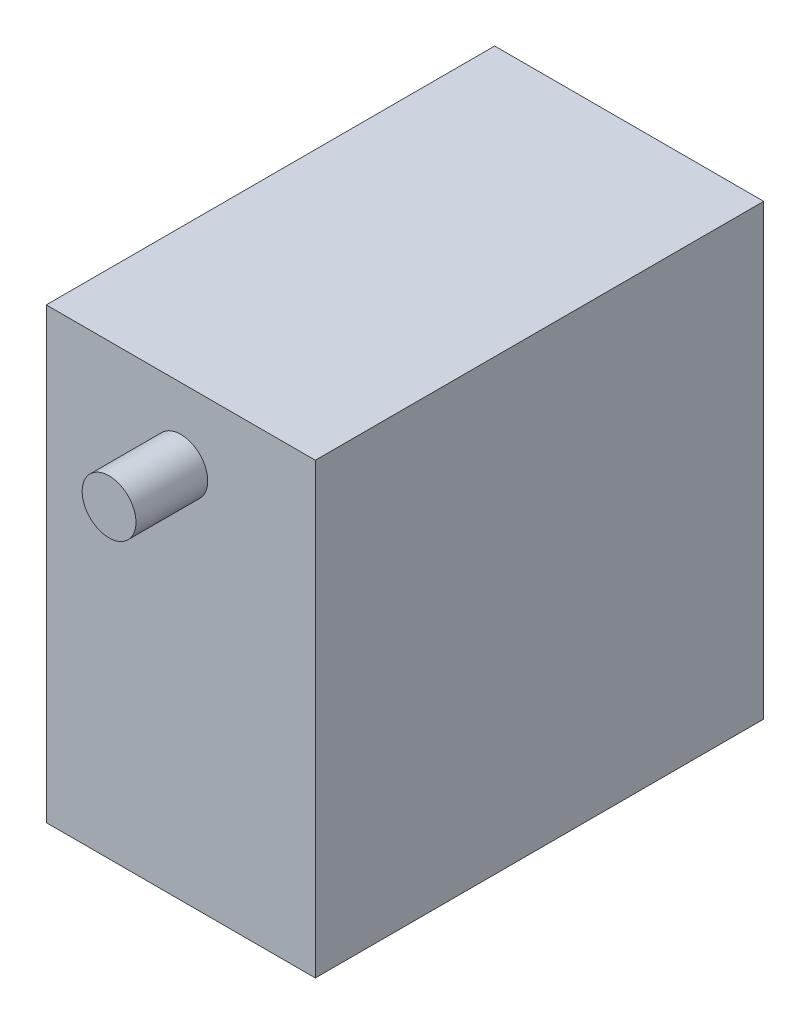
from build123d import *

# Parameters (mm, degrees)
SKETCH_1_W      = 30
SKETCH_1_H      = 50
EXTRUDE_1_DEPTH = 50
SKETCH_2_R      = 3
EXTRUDE_2_DEPTH = 8


with BuildPart() as part:
    # 草图1 → 凸台-拉伸1 (new body)
    with BuildSketch(Plane.XY):
        Rectangle(SKETCH_1_W, SKETCH_1_H)
    extrude(amount=EXTRUDE_1_DEPTH)

    # 草图2 → 凸台-拉伸2 (add)
    with BuildSketch(Plane.XY.offset(50)):
        with Locations(Location((0, 17, 0), (0, 0, 180))):
            Circle(SKETCH_2_R)
    extrude(amount=EXTRUDE_2_DEPTH)


solid = part.part
